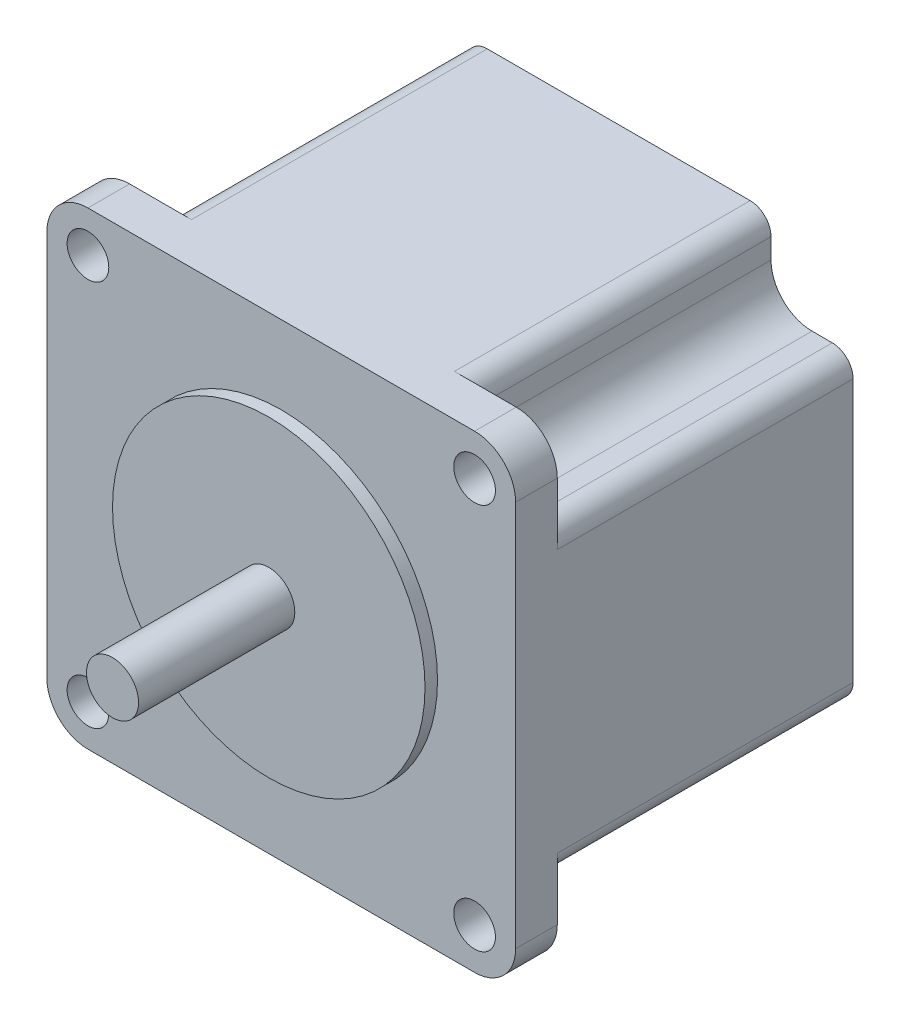
from build123d import *

# Parameters (mm, degrees)
SKETCH1_R          = 2.54
EXTRUDE1_DEPTH     = 20.574
SKETCH2_R          = 19.05
EXTRUDE2_DEPTH     = 1.524
SKETCH3_R          = 3.175
EXTRUDE3_DEPTH     = 20.574
EXTRUDE4_START     = -36.068
EXTRUDE4_DEPTH     = 36.068
FILLET1_R          = 2.54
EXTRUDE5_START     = 14.986
SKETCH5_R          = 3.175
EXTRUDE5_DEPTH     = 14.986
SKETCH6_R          = 1.07823
EXTRUDE6_DEPTH     = 3.81
SKETCH9_W          = 27.159483829
SKETCH9_H          = 18.094101739
CUT_EXTRUDE1_DEPTH = 56.642


with BuildPart() as part:
    # Sketch1 → Extrude1 (new, symmetric)
    with BuildSketch(Plane.XY):
        with BuildLine():
            Line((-23.5712, 28.575), (23.5712, 28.575))
            ThreePointArc((23.5712, 28.575), (27.109420912, 27.109420912), (28.575, 23.5712))
            Line((28.575, 23.5712), (28.575, -23.5712))
            ThreePointArc((28.575, -23.5712), (27.109420912, -27.109420912), (23.5712, -28.575))
            Line((23.5712, -28.575), (-23.5712, -28.575))
            ThreePointArc((-23.5712, -28.575), (-27.109420912, -27.109420912), (-28.575, -23.5712))
            Line((-28.575, -23.5712), (-28.575, 23.5712))
            ThreePointArc((-28.575, 23.5712), (-27.109420912, 27.109420912), (-23.5712, 28.575))
        make_face()
        with Locations((-23.5712, 23.5712)):
            Circle(SKETCH1_R, mode=Mode.SUBTRACT)
        with Locations((23.5712, 23.5712)):
            Circle(SKETCH1_R, mode=Mode.SUBTRACT)
        with Locations((23.5712, -23.5712)):
            Circle(SKETCH1_R, mode=Mode.SUBTRACT)
        with Locations((-23.5712, -23.5712)):
            Circle(SKETCH1_R, mode=Mode.SUBTRACT)
    extrude(amount=EXTRUDE1_DEPTH, both=True)

    # Sketch2 → Extrude2 (add)
    with BuildSketch(Plane.XY.offset(20.574)):
        with Locations(Location((0, 0, 0), (0, 0, 180))):
            Circle(SKETCH2_R)
    extrude(amount=EXTRUDE2_DEPTH)

    # Sketch3 → Extrude3 (add)
    with BuildSketch(Plane.XY.offset(20.574)):
        Circle(SKETCH3_R)
    extrude(amount=EXTRUDE3_DEPTH)

    # Sketch4 → Extrude4 (cut)
    with BuildSketch(Plane(origin=(0, 0, -20.574), x_dir=(-1, 0, 0), z_dir=(0, 0, -1)).offset(EXTRUDE4_START)):
        with BuildLine():
            Line((-23.5712, 18.5674), (-28.575, 18.5674))
            Line((-28.575, 18.5674), (-28.575, 23.5712))
            ThreePointArc((-28.575, 23.5712), (-27.109420912, 27.109420912), (-23.5712, 28.575))
            Line((-23.5712, 28.575), (-18.5674, 28.575))
            Line((-18.5674, 28.575), (-18.5674, 23.5712))
            ThreePointArc((-18.5674, 23.5712), (-20.032979088, 20.032979088), (-23.5712, 18.5674))
        make_face()
        with BuildLine():
            Line((23.5712, 18.5674), (28.575, 18.5674))
            Line((28.575, 18.5674), (28.575, 23.5712))
            ThreePointArc((28.575, 23.5712), (27.109420912, 27.109420912), (23.5712, 28.575))
            Line((23.5712, 28.575), (18.5674, 28.575))
            Line((18.5674, 28.575), (18.5674, 23.5712))
            ThreePointArc((18.5674, 23.5712), (20.032979088, 20.032979088), (23.5712, 18.5674))
        make_face()
        with BuildLine():
            Line((23.5712, -18.5674), (28.575, -18.5674))
            Line((28.575, -18.5674), (28.575, -23.5712))
            ThreePointArc((28.575, -23.5712), (27.109420912, -27.109420912), (23.5712, -28.575))
            Line((23.5712, -28.575), (18.5674, -28.575))
            Line((18.5674, -28.575), (18.5674, -23.5712))
            ThreePointArc((18.5674, -23.5712), (20.032979088, -20.032979088), (23.5712, -18.5674))
        make_face()
        with BuildLine():
            Line((-18.5674, -23.5712), (-18.5674, -28.575))
            Line((-18.5674, -28.575), (-23.5712, -28.575))
            ThreePointArc((-23.5712, -28.575), (-27.109420912, -27.109420912), (-28.575, -23.5712))
            Line((-28.575, -23.5712), (-28.575, -18.5674))
            Line((-28.575, -18.5674), (-23.5712, -18.5674))
            ThreePointArc((-23.5712, -18.5674), (-20.032979088, -20.032979088), (-18.5674, -23.5712))
        make_face()
    extrude(amount=EXTRUDE4_DEPTH, mode=Mode.SUBTRACT)

    # Fillet1
    fillet1_edges = [part.edges().sort_by_distance(p)[0] for p in [
        (28.575, -18.5674, -2.54),
        (18.5674, -28.575, -2.54),
        (18.5674, 28.575, -2.54),
        (28.575, 18.5674, -2.54),
        (-28.575, 18.5674, -2.54),
        (-18.5674, 28.575, -2.54),
        (-18.5674, -28.575, -2.54),
        (-28.575, -18.5674, -2.54),
    ]]
    fillet(fillet1_edges, radius=FILLET1_R)

    # Sketch5 → Extrude5 (add)
    with BuildSketch(Plane(origin=(0, 0, -20.574), x_dir=(-1, 0, 0), z_dir=(0, 0, -1)).offset(EXTRUDE5_START)):
        with Locations(Location((0, 0, 0), (0, 0, 180))):
            Circle(SKETCH5_R)
    extrude(amount=-EXTRUDE5_DEPTH)

    # Sketch6 → Extrude6 (cut)
    with BuildSketch(Plane(origin=(0, 0, -20.574), x_dir=(-1, 0, 0), z_dir=(0, 0, -1))):
        with Locations((-23.0124, 0)):
            Circle(SKETCH6_R)
        with Locations((23.0124, 0)):
            Circle(SKETCH6_R)
    extrude(amount=-EXTRUDE6_DEPTH, mode=Mode.SUBTRACT)

    # Sketch9 → Cut-Extrude1 (cut)
    with BuildSketch(Plane.XZ.offset(28.575)):
        with Locations((-0.774509995, -29.62105087)):
            Rectangle(SKETCH9_W, SKETCH9_H)
    extrude(amount=-CUT_EXTRUDE1_DEPTH, mode=Mode.SUBTRACT)


solid = part.part
